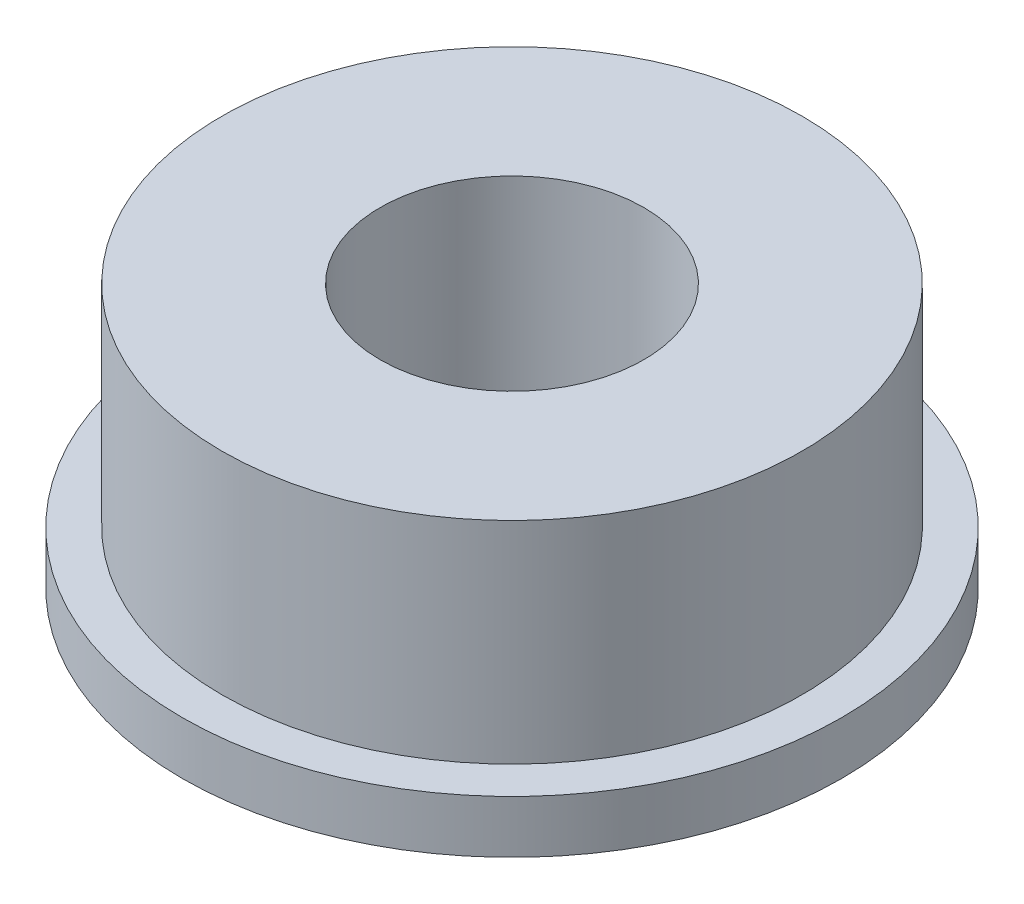
from build123d import *
from build123d.topology import SkipClean

# Parameters (mm, degrees)
SKETCH1_R           = 5.5
SKETCH1_R_2         = 2.5
BOSS_EXTRUDE1_DEPTH = 4
BOSS_EXTRUDE2_START = 1
SKETCH2_R           = 6.25
SKETCH2_R_2         = 2.5
BOSS_EXTRUDE2_DEPTH = 1


with BuildPart() as part:
    # Sketch1 → Boss-Extrude1 (new body)
    with BuildSketch(Plane(origin=(0, 0, 0), x_dir=(1, 0, 0), z_dir=(0, 1, 0))):
        with Locations(Location((0, 0, 0), (0, 0, 270))):
            Circle(SKETCH1_R)
        with Locations(Location((0, 0, 0), (0, 0, 270))):
            Circle(SKETCH1_R_2, mode=Mode.SUBTRACT)
    extrude(amount=BOSS_EXTRUDE1_DEPTH)

    # Sketch2 → Boss-Extrude2 (add)
    with SkipClean():  # the faces are left unmerged after this step: merging them gives an invalid solid
        with BuildSketch(Plane.XZ.offset(BOSS_EXTRUDE2_START)):
            with Locations(Location((0, 0, 0), (0, 0, 270))):
                Circle(SKETCH2_R)
            with Locations(Location((0, 0, 0), (0, 0, 270))):
                Circle(SKETCH2_R_2, mode=Mode.SUBTRACT)
        extrude(amount=-BOSS_EXTRUDE2_DEPTH)


solid = part.part
